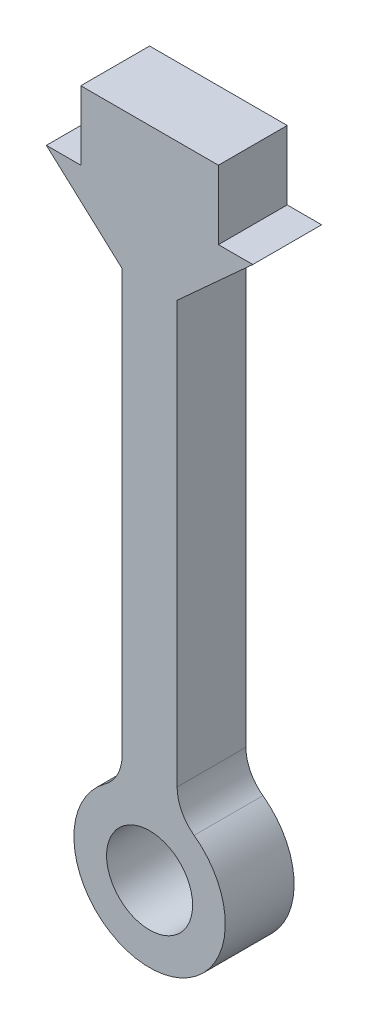
from build123d import *

# Parameters (mm, degrees)
ESQUISSE1_W        = 2
ESQUISSE1_H        = 2
BOSS_EXTRU_1_DEPTH = 2
CONG_1_R           = 1.2


with BuildPart() as part:
    # Esquisse1 → Boss.-Extru.1 (new body)
    with BuildSketch(Plane.XY):
        with BuildLine():
            Line((2.198395722, -3.372264328), (0.598395722, -3.372264328))
            Line((0.598395722, -3.372264328), (0.598395722, -16.322874175))
            ThreePointArc((0.598395722, -16.322874175), (1.398395722, -16.172264328), (2.198395722, -16.322874175))
            Line((2.198395722, -16.322874175), (2.198395722, -3.372264328))
        make_face()
        Polygon((-0.601604278, -1.372264328), (-1.601604278, -1.372264328), (0.598395722, -3.372264328), (2.198395722, -3.372264328), (4.398395722, -1.372264328), (3.398395722, -1.372264328), (1.398395722, -1.372264328), align=None)
        with Locations((2.398395722, -0.372264328)):
            Rectangle(ESQUISSE1_W, ESQUISSE1_H)
        with Locations((0.398395722, -0.372264328)):
            Rectangle(ESQUISSE1_W, ESQUISSE1_H)
        with BuildLine():
            ThreePointArc((2.198395722, -16.322874175), (1.398395722, -16.172264328), (0.598395722, -16.322874175))
            Line((0.598395722, -16.322874175), (0.598395722, -17.411795692))
            ThreePointArc((0.598395722, -17.411795692), (1.398395722, -17.122264328), (2.198395722, -17.411795692))
            Line((2.198395722, -17.411795692), (2.198395722, -16.322874175))
        make_face()
        with BuildLine():
            Line((0.598395722, -17.411795692), (0.598395722, -16.322874175))
            ThreePointArc((0.598395722, -16.322874175), (0.157428357, -20.188854541), (3.598395722, -18.372264328))
            ThreePointArc((3.598395722, -18.372264328), (3.214985934, -17.131296963), (2.198395722, -16.322874175))
            Line((2.198395722, -16.322874175), (2.198395722, -17.411795692))
            ThreePointArc((2.198395722, -17.411795692), (2.530318864, -17.841934242), (2.648395722, -18.372264328))
            ThreePointArc((2.648395722, -18.372264328), (0.868065636, -19.50418747), (0.598395722, -17.411795692))
        make_face()
    extrude(amount=BOSS_EXTRU_1_DEPTH)

    # Congé1
    cong_1_edges = [part.edges().sort_by_distance(p)[0] for p in [
        (2.198395722, -16.322874175, 1),
        (0.598395722, -16.322874175, 1),
    ]]
    fillet(cong_1_edges, radius=CONG_1_R)


solid = part.part
